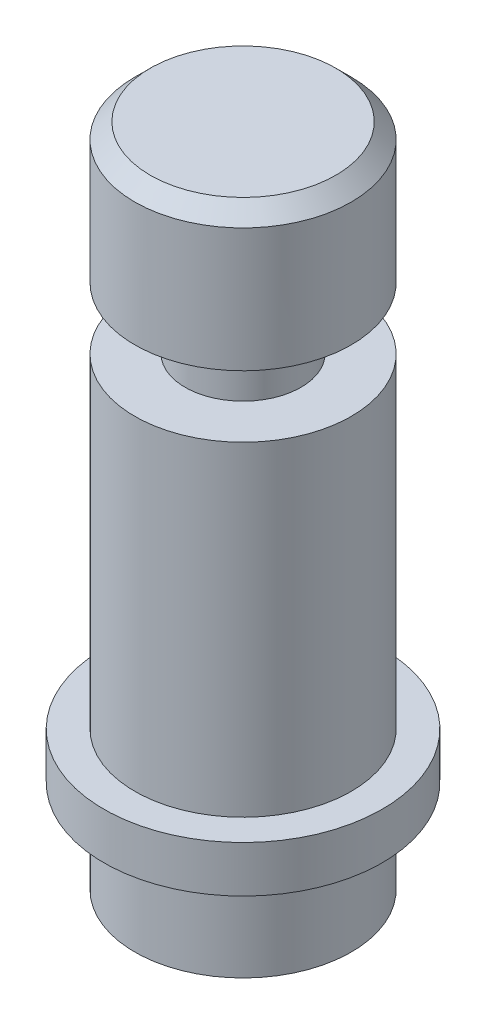
from build123d import *

# Parameters (mm, degrees)
TOP_CHAMFER_SIZE = 1


with BuildPart() as part:
    # Sketch1 → Main Body (revolve)
    with BuildSketch(Plane.XY, mode=Mode.PRIVATE) as main_body_sk:
        Polygon((0, 0), (7, 0), (7, 6), (9, 6), (9, 9), (7, 9), (7, 30), (3.75, 30), (3.75, 34), (7, 34), (7, 43), (0, 43), align=None)
    revolve(main_body_sk.sketch.rotate(Axis((0, 0, 0), (0, 1, 0)), 90), axis=Axis((0, 0, 0), (0, 1, 0)))

    # Top Chamfer
    top_chamfer_edges = [part.edges().sort_by_distance(p)[0] for p in [
        (0, 43, 7),
    ]]
    chamfer(top_chamfer_edges, length=TOP_CHAMFER_SIZE)


solid = part.part
